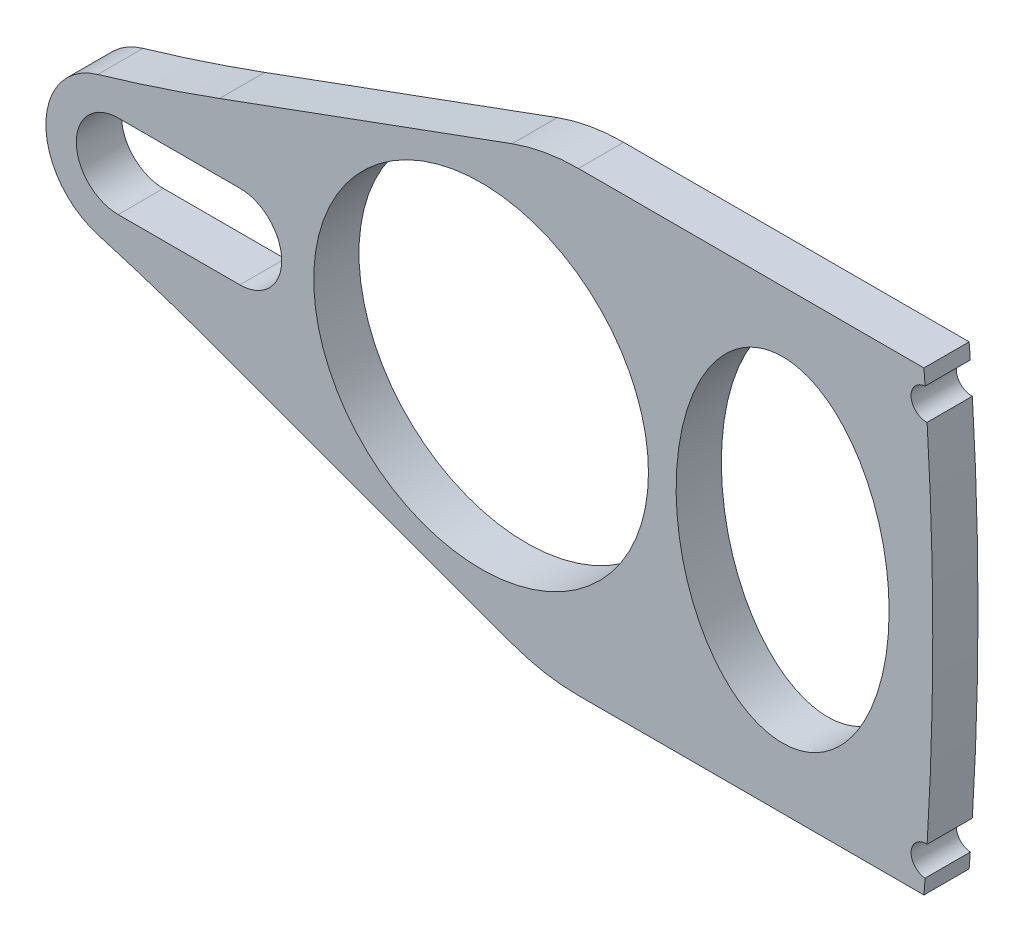
from build123d import *

# Parameters (mm, degrees)
SKETCH1_R           = 11.1010859
SKETCH1_RX          = 11.1010859
SKETCH1_RY          = 7.064327391
BOSS_EXTRUDE1_DEPTH = 3


with BuildPart() as part:
    # Sketch1 → Boss-Extrude1 (new body)
    with BuildSketch(Plane.XY):
        with BuildLine():
            Line((-7.932990682, 20.184750419), (-30.848746588, 20.184750419))
            ThreePointArc((-30.848746588, 20.184750419), (-33.08604518, 19.987967105), (-35.254642351, 19.403659848))
            Line((-35.254642351, 19.403659848), (-54.653402891, 12.302327865))
            ThreePointArc((-54.653402891, 12.302327865), (-58.666824966, 10.908120177), (-62.724252982, 9.647703691))
            ThreePointArc((-62.724252982, 9.647703691), (-66.171891815, 5.046906011), (-62.724252982, 0.446108331))
            ThreePointArc((-62.724252982, 0.446108331), (-58.666824966, -0.814308155), (-54.653402891, -2.208515844))
            Line((-54.653402891, -2.208515844), (-35.254642351, -9.309847827))
            ThreePointArc((-35.254642351, -9.309847827), (-33.08604518, -9.894155084), (-30.848746588, -10.090938398))
            Line((-30.848746588, -10.090938398), (-7.932990682, -10.090938398))
            ThreePointArc((-7.932990682, -10.090938398), (-7.894597342, -9.587802543), (-7.857501769, -9.084569342))
            ThreePointArc((-7.857501769, -9.084569342), (-8.582242574, -8.686691615), (-8.76641518, -7.880691384))
            ThreePointArc((-8.76641518, -7.880691384), (-8.395240322, -7.281098542), (-7.722112775, -7.070904212))
            ThreePointArc((-7.722112775, -7.070904212), (-7.346484021, 5.046906011), (-7.722112775, 17.164716233))
            ThreePointArc((-7.722112775, 17.164716233), (-8.539635898, 17.511679242), (-8.76641518, 18.370340144))
            ThreePointArc((-8.76641518, 18.370340144), (-8.447347212, 18.926650806), (-7.857501769, 19.178381363))
            ThreePointArc((-7.857501769, 19.178381363), (-7.894597342, 19.681614565), (-7.932990682, 20.184750419))
        make_face()
        with Locations((-37.304724068, 5.046906011)):
            Circle(SKETCH1_R, mode=Mode.SUBTRACT)
        with Locations(Location((-17.304724068, 5.046906011), (0, 0, -90))):
            Ellipse(SKETCH1_RX, SKETCH1_RY, mode=Mode.SUBTRACT)
        with BuildLine():
            Line((-53.304724068, 2.271634536), (-61.378241086, 2.271634536))
            ThreePointArc((-61.378241086, 2.271634536), (-64.153512561, 5.046906011), (-61.378241086, 7.822177486))
            Line((-61.378241086, 7.822177486), (-53.304724068, 7.822177486))
            ThreePointArc((-53.304724068, 7.822177486), (-50.529452593, 5.046906011), (-53.304724068, 2.271634536))
        make_face(mode=Mode.SUBTRACT)
    extrude(amount=BOSS_EXTRUDE1_DEPTH)


solid = part.part
